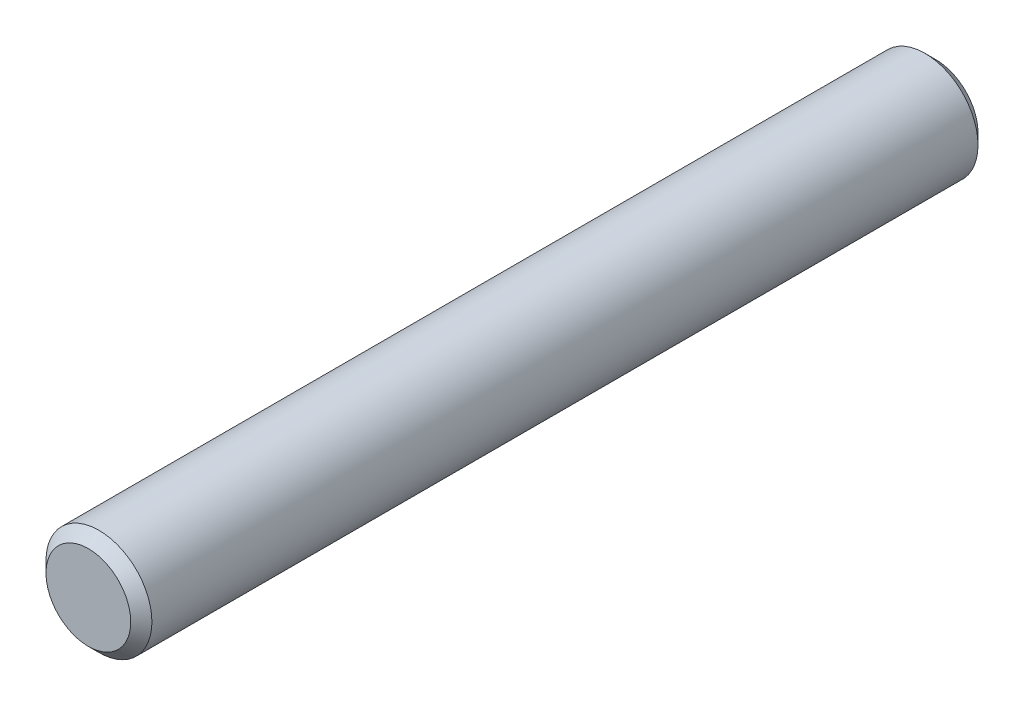
from build123d import *

# Parameters (mm, degrees)
SKETCH3_R           = 3.175
BOSS_EXTRUDE1_DEPTH = 25.4
CHAMFER1_SIZE       = 0.635


with BuildPart() as part:
    # Sketch3 → Boss-Extrude1 (new, symmetric)
    with BuildSketch(Plane.XY):
        Circle(SKETCH3_R)
    extrude(amount=BOSS_EXTRUDE1_DEPTH, both=True)

    # Chamfer1
    chamfer1_edges = [part.edges().sort_by_distance(p)[0] for p in [
        (-3.175, 0, -25.4),
        (-3.175, 0, 25.4),
    ]]
    chamfer(chamfer1_edges, length=CHAMFER1_SIZE)


solid = part.part
